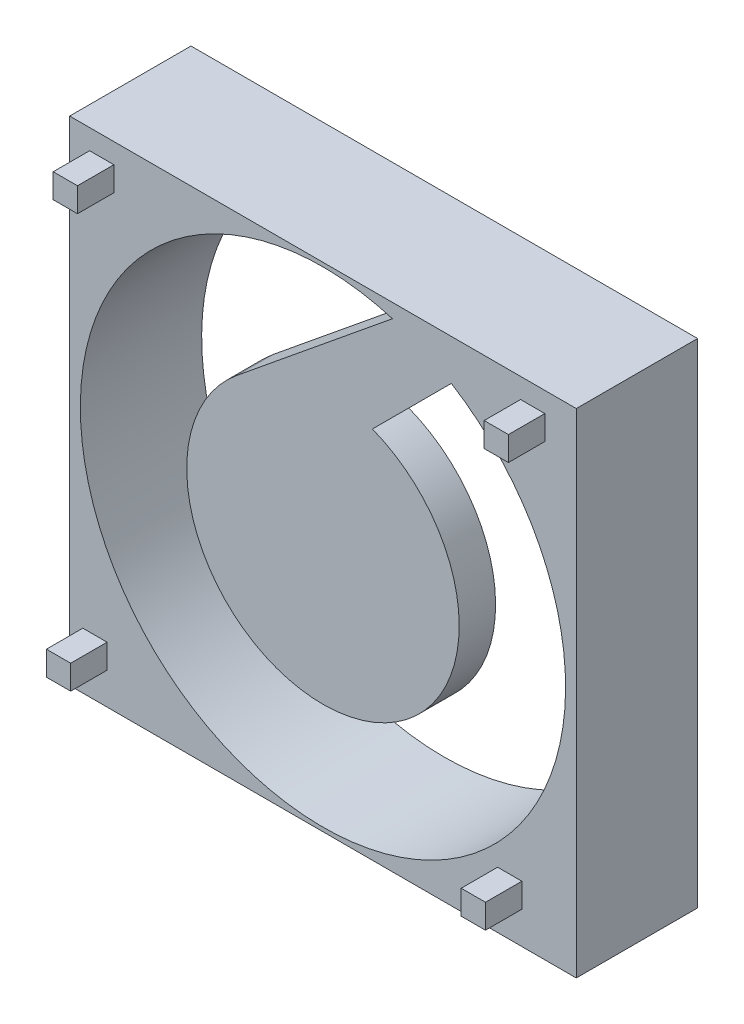
from build123d import *

# Parameters (mm, degrees)
SKETCH1_W           = 41.760012726
SKETCH1_H           = 40.652739662
SKETCH1_R           = 20
BOSS_EXTRUDE1_DEPTH = 10
BOSS_EXTRUDE2_START = -3
BOSS_EXTRUDE2_DEPTH = 3
SKETCH3_W           = 2
SKETCH3_H           = 2
BOSS_EXTRUDE3_DEPTH = 3


with BuildPart() as part:
    # Sketch1 → Boss-Extrude1 (new body)
    with BuildSketch(Plane.XY):
        Rectangle(SKETCH1_W, SKETCH1_H)
        Circle(SKETCH1_R, mode=Mode.SUBTRACT)
    extrude(amount=BOSS_EXTRUDE1_DEPTH)

    # Sketch2 → Boss-Extrude2 (add)
    with BuildSketch(Plane.XY.offset(10).offset(BOSS_EXTRUDE2_START)):
        with BuildLine():
            Line((-7.096476546, 8.702942047), (5.729829486, 19.161655828))
            ThreePointArc((5.729829486, 19.161655828), (8.229395138, 18.228468275), (10.582504972, 16.970874713))
            Line((10.582504972, 16.970874713), (4.075462496, 10.463832237))
            ThreePointArc((4.075462496, 10.463832237), (1.74837497, -11.092536437), (-7.096476546, 8.702942047))
        make_face()
    extrude(amount=BOSS_EXTRUDE2_DEPTH)

    # Sketch3 → Boss-Extrude3 (add)
    with BuildSketch(Plane.XY.offset(10)):
        with Locations((15.395513793, -16.659790737)):
            Rectangle(SKETCH3_W, SKETCH3_H)
        with Locations((17.287307426, 17.672760389)):
            Rectangle(SKETCH3_W, SKETCH3_H)
        with Locations((-18.796904472, -16.691717232)):
            Rectangle(SKETCH3_W, SKETCH3_H)
        with Locations((-18.236373025, 17.672760389)):
            Rectangle(SKETCH3_W, SKETCH3_H)
    extrude(amount=BOSS_EXTRUDE3_DEPTH)


solid = part.part
